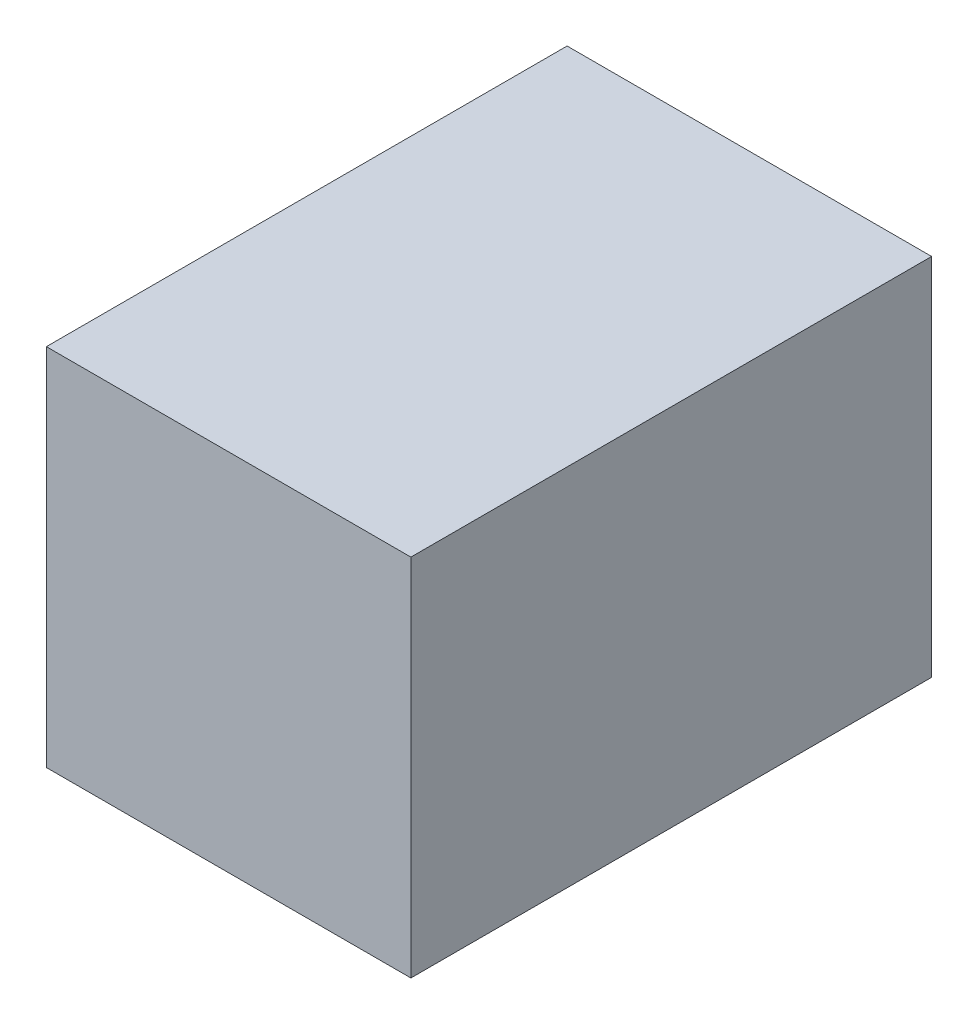
from build123d import *

# Parameters (mm, degrees)
ESQUISSE1_W             = 35
ESQUISSE1_H             = 35
BOSS_EXTRU_1_DEPTH      = 50
ESQUISSE2_W             = 30
ESQUISSE2_H             = 30
ENL_V_MAT_EXTRU_1_DEPTH = 45


with BuildPart() as part:
    # Esquisse1 → Boss.-Extru.1 (new body)
    with BuildSketch(Plane.XY):
        Rectangle(ESQUISSE1_W, ESQUISSE1_H)
    extrude(amount=BOSS_EXTRU_1_DEPTH)

    # Esquisse2 → Enlèv. mat.-Extru.1 (cut)
    with BuildSketch(Plane(origin=(0, 0, 0), x_dir=(-1, 0, 0), z_dir=(0, 0, -1))):
        Rectangle(ESQUISSE2_W, ESQUISSE2_H)
    extrude(amount=-ENL_V_MAT_EXTRU_1_DEPTH, mode=Mode.SUBTRACT)


solid = part.part
